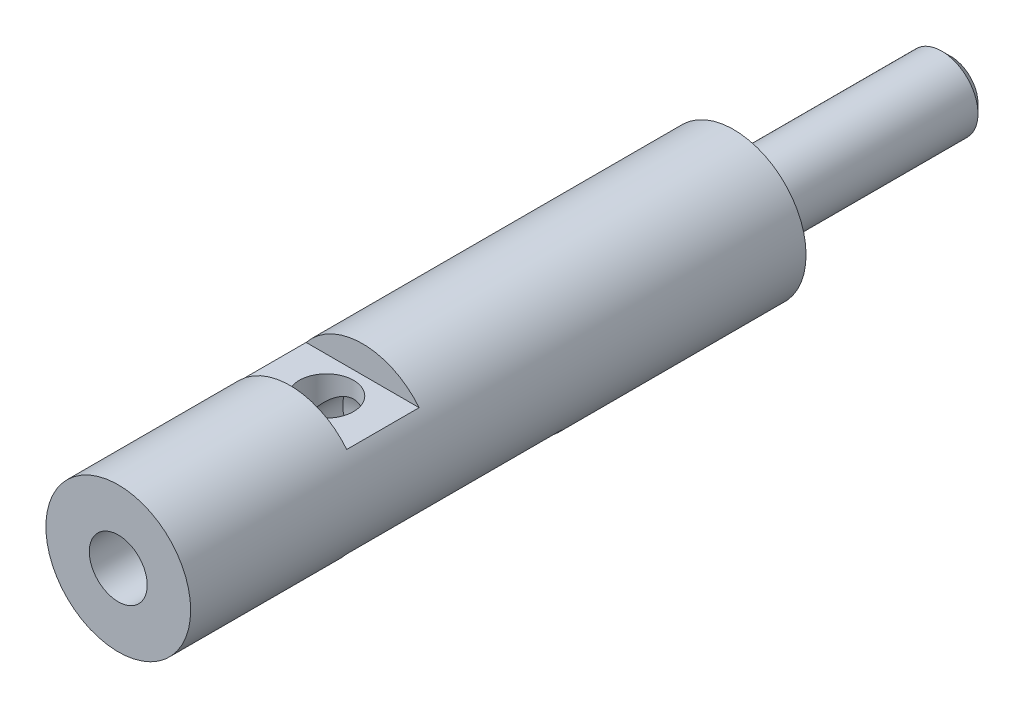
from build123d import *

# Parameters (mm, degrees)
SKETCH1_R                      = 4
BOSS_EXTRUDE1_DEPTH            = 34
SKETCH2_R                      = 2
BOSS_EXTRUDE2_DEPTH            = 12
CHAMFER1_SIZE                  = 0.5
F_3_2_3_2_DIAMETER_HOLE1_D     = 3.2
F_3_2_3_2_DIAMETER_HOLE1_DEPTH = 14
F_3_2_3_2_DIAMETER_HOLE1_TIP   = 0.96137699
CUT_EXTRUDE2_DEPTH             = 35.467375879
CUT_EXTRUDE2_DEPTH_BACK        = 35.467375879
SKETCH5_W                      = 12
SKETCH5_H                      = 1.5
SKETCH5_W_2                    = 4
F_3_0_3_DIAMETER_HOLE1_REACH   = 36.846
F_3_0_3_DIAMETER_HOLE1_BORE_R  = 1.5


with BuildPart() as part:
    # Sketch1 → Boss-Extrude1 (new body)
    with BuildSketch(Plane.XY):
        Circle(SKETCH1_R)
    extrude(amount=BOSS_EXTRUDE1_DEPTH)

    # Sketch2 → Boss-Extrude2 (add)
    with BuildSketch(Plane(origin=(0, 0, 0), x_dir=(-1, 0, 0), z_dir=(0, 0, -1))):
        Circle(SKETCH2_R)
    extrude(amount=BOSS_EXTRUDE2_DEPTH)

    # Chamfer1
    chamfer1_edges = [part.edges().sort_by_distance(p)[0] for p in [
        (2, 0, -12),
    ]]
    chamfer(chamfer1_edges, length=CHAMFER1_SIZE)

    # Ø3.2 (3.2) Diameter Hole1
    with Locations(Plane.XY.offset(34)):
        with Locations((0, 0)):
            Hole(F_3_2_3_2_DIAMETER_HOLE1_D / 2, depth=F_3_2_3_2_DIAMETER_HOLE1_DEPTH)
            with Locations((0, 0, -(F_3_2_3_2_DIAMETER_HOLE1_DEPTH + F_3_2_3_2_DIAMETER_HOLE1_TIP / 2))):  # 118° drill point
                Cone(0, F_3_2_3_2_DIAMETER_HOLE1_D / 2, F_3_2_3_2_DIAMETER_HOLE1_TIP, mode=Mode.SUBTRACT)

    # Sketch5 → Cut-Extrude2 (cut, two sides: drawn at the far end of the back side and taken through both)
    with BuildSketch(Plane(origin=(0, 0, 0), x_dir=(0, 0, -1), z_dir=(1, 0, 0)).offset(-CUT_EXTRUDE2_DEPTH_BACK)):
        with Locations((-18.5, -3.25)):
            Rectangle(SKETCH5_W, SKETCH5_H)
        with Locations((-22.5, 3.25)):
            Rectangle(SKETCH5_W_2, SKETCH5_H)
    extrude(amount=CUT_EXTRUDE2_DEPTH + CUT_EXTRUDE2_DEPTH_BACK, mode=Mode.SUBTRACT)

    # Ø3.0 (3) Diameter Hole1 bore → Ø3.0 (3) Diameter Hole1 (cut, up to next)
    with BuildSketch(Plane(origin=(0, 2.5, 0), x_dir=(1, 0, 0), z_dir=(0, 1, 0)), mode=Mode.PRIVATE) as f_3_0_3_diameter_hole1_sk1:
        with Locations((0, -22.5)):
            Circle(F_3_0_3_DIAMETER_HOLE1_BORE_R)
    f_3_0_3_diameter_hole1_tool1 = extrude(f_3_0_3_diameter_hole1_sk1.sketch, amount=-F_3_0_3_DIAMETER_HOLE1_REACH, mode=Mode.PRIVATE) & part.part
    add(f_3_0_3_diameter_hole1_tool1.solids().sort_by_distance((0, 2.5, 22.5))[0], mode=Mode.SUBTRACT)


solid = part.part
